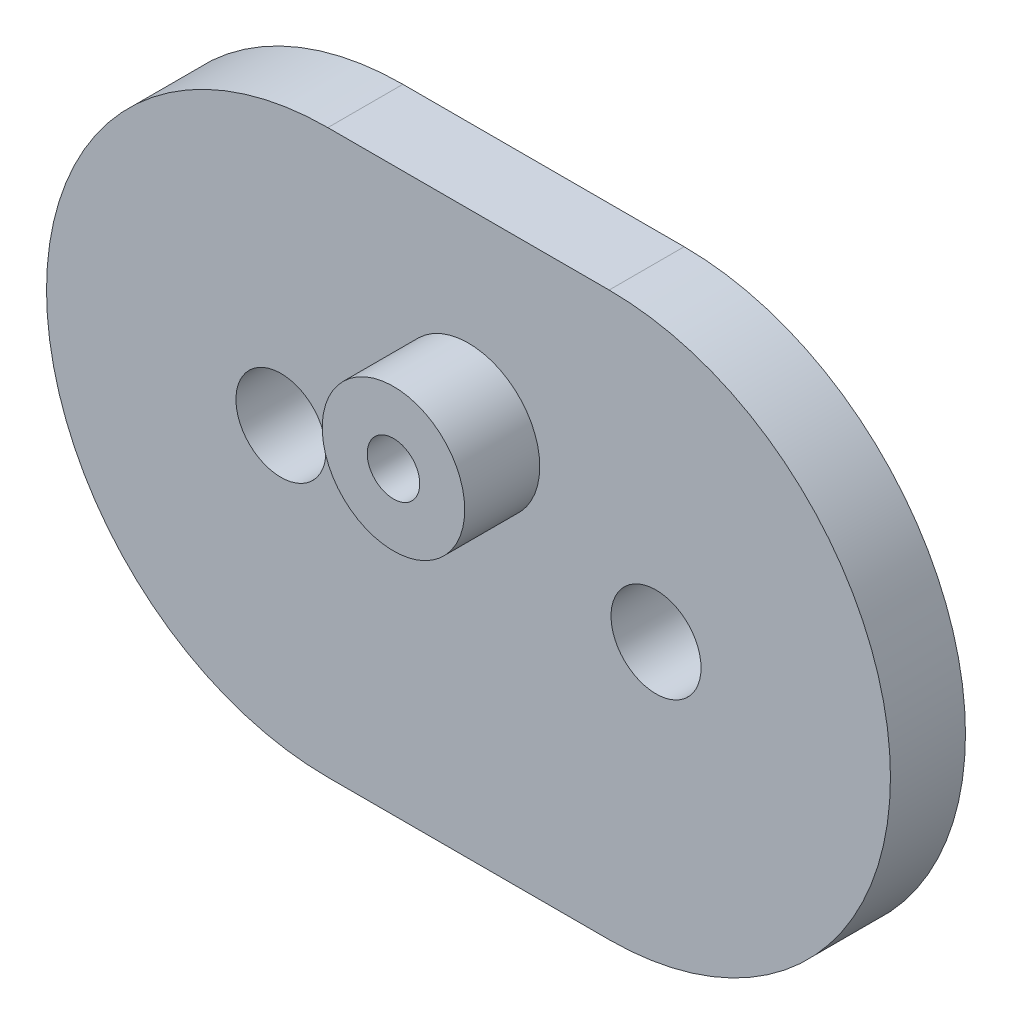
from build123d import *

# Parameters (mm, degrees)
SKETCH_1_R      = 2.4
SKETCH_1_R_2    = 3.8
EXTRUDE_1_DEPTH = 4
SKETCH_1_3_R    = 3.8
SKETCH_1_3_R_2  = 1.4
EXTRUDE_2_DEPTH = 8


with BuildPart() as part:
    # 草图1 → 凸台-拉伸1 (new body)
    with BuildSketch(Plane.XY):
        with BuildLine():
            Line((7.5, 15), (-7.5, 15))
            ThreePointArc((-7.5, 15), (-22.5, 0), (-7.5, -15))
            Line((-7.5, -15), (7.5, -15))
            ThreePointArc((7.5, -15), (22.5, 0), (7.5, 15))
        make_face()
        with Locations((-10, 0)):
            Circle(SKETCH_1_R, mode=Mode.SUBTRACT)
        with Locations((10, 0)):
            Circle(SKETCH_1_R, mode=Mode.SUBTRACT)
        with Locations((0, 5)):
            Circle(SKETCH_1_R_2, mode=Mode.SUBTRACT)
    extrude(amount=EXTRUDE_1_DEPTH)

    # 草图1<3> → 凸台-拉伸2 (add)
    with BuildSketch(Plane.XY):
        with Locations((0, 5)):
            Circle(SKETCH_1_3_R)
        with Locations((0, 5)):
            Circle(SKETCH_1_3_R_2, mode=Mode.SUBTRACT)
    extrude(amount=EXTRUDE_2_DEPTH)


solid = part.part
